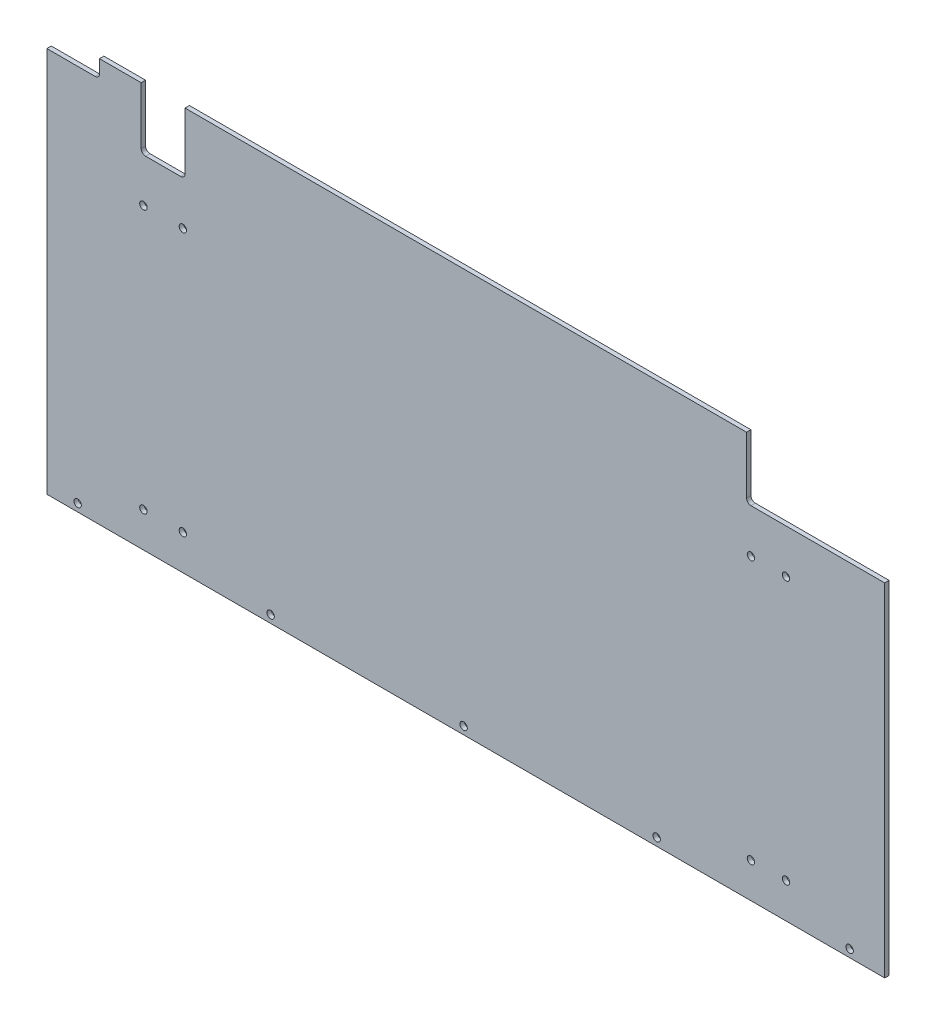
from build123d import *

# Parameters (mm, degrees)
SKETCH1_W                        = 1212.85
SKETCH1_H                        = 584.2
BOSS_EXTRUDE1_DEPTH              = 3.175
SKETCH2_R                        = 5.3578125
SKETCH2_W                        = 63.5
SKETCH2_H                        = 88.9
CUT_EXTRUDE1_DEPTH               = 674.137439996
FILLET1_R                        = 6.35
SKETCH3_W                        = 142.875
SKETCH3_H                        = 88.9
CUT_EXTRUDE2_DEPTH               = 674.137439996
F_27_64_0_42188_DIAMETER_HOLE1_D = 10.715752
LPATTERN1_COUNT                  = 5
LPATTERN1_PITCH                  = 279.4
CUT_EXTRUDE3_DEPTH               = 674.137439996


with BuildPart() as part:
    # Sketch1 → Boss-Extrude1 (new, symmetric)
    with BuildSketch(Plane.XY):
        Rectangle(SKETCH1_W, SKETCH1_H)
    extrude(amount=BOSS_EXTRUDE1_DEPTH, both=True)

    # Sketch2 → Cut-Extrude1 (cut, through all)
    with BuildSketch(Plane.XY.offset(3.175)):
        with Locations((-466.725, 139.7)):
            Circle(SKETCH2_R)
        with Locations((-409.575, 139.7)):
            Circle(SKETCH2_R)
        with Locations((-466.725, -241.3)):
            Circle(SKETCH2_R)
        with Locations((-409.575, -241.3)):
            Circle(SKETCH2_R)
        with Locations((412.75, 139.7)):
            Circle(SKETCH2_R)
        with Locations((463.55, 139.7)):
            Circle(SKETCH2_R)
        with Locations((412.75, -241.3)):
            Circle(SKETCH2_R)
        with Locations((463.55, -241.3)):
            Circle(SKETCH2_R)
        with Locations((438.15, 247.65)):
            Rectangle(SKETCH2_W, SKETCH2_H)
        with Locations((-438.15, 247.65)):
            Rectangle(SKETCH2_W, SKETCH2_H)
    extrude(amount=-CUT_EXTRUDE1_DEPTH, mode=Mode.SUBTRACT)

    # Fillet1
    fillet1_edges = [part.edges().sort_by_distance(p)[0] for p in [
        (-406.4, 203.2, 0),
        (-469.9, 203.2, 0),
        (469.9, 203.2, 0),
        (406.4, 203.2, 0),
    ]]
    fillet(fillet1_edges, radius=FILLET1_R)

    # Sketch3 → Cut-Extrude2 (cut, through all)
    with BuildSketch(Plane.XY.offset(3.175)):
        with Locations((534.9875, 247.65)):
            Rectangle(SKETCH3_W, SKETCH3_H)
    extrude(amount=-CUT_EXTRUDE2_DEPTH, mode=Mode.SUBTRACT)

    # 27/64 (0.42188) Diameter Hole1 (through all)
    with Locations(Plane.XY.offset(3.175)):
        with Locations((-561.975, -280.9875)):
            f_27_64_0_42188_diameter_hole1 = Hole(F_27_64_0_42188_DIAMETER_HOLE1_D / 2)

    # LPattern1: 27/64 (0.42188) Diameter Hole1 ×5
    with Locations(*[(i * LPATTERN1_PITCH, 0, 0) for i in range(1, LPATTERN1_COUNT)]):
        add(f_27_64_0_42188_diameter_hole1, mode=Mode.SUBTRACT)

    # Sketch6 → Cut-Extrude3 (cut, through all)
    with BuildSketch(Plane.XY.offset(3.175)):
        with BuildLine():
            Line((-606.425, 292.1), (-606.425, 266.7))
            Line((-606.425, 266.7), (-536.575, 266.7))
            ThreePointArc((-536.575, 266.7), (-532.084871939, 268.559871939), (-530.225, 273.05))
            Line((-530.225, 273.05), (-530.225, 292.1))
            Line((-530.225, 292.1), (-606.425, 292.1))
        make_face()
    extrude(amount=-CUT_EXTRUDE3_DEPTH, mode=Mode.SUBTRACT)


solid = part.part
